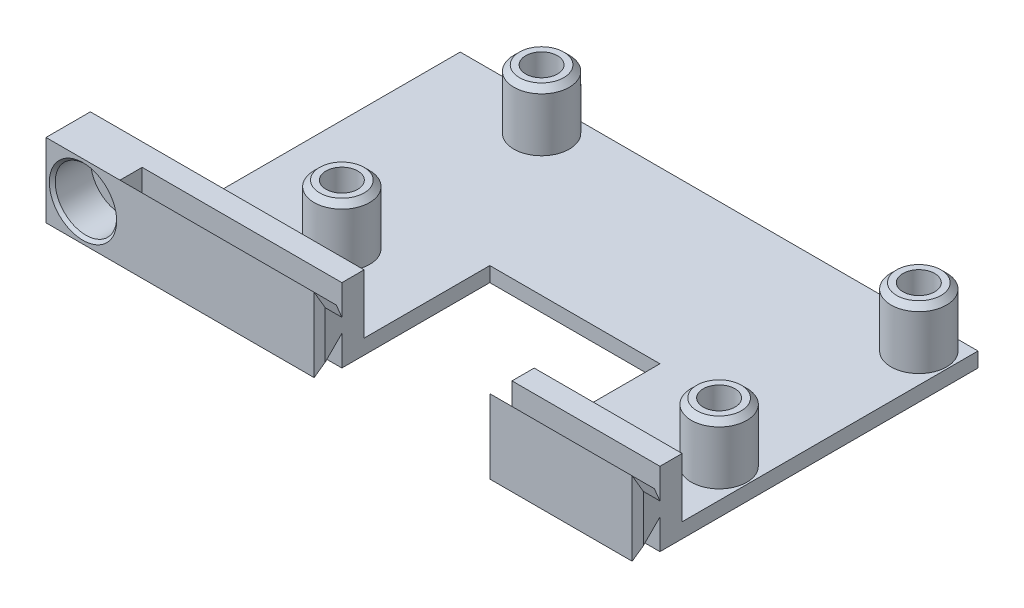
from build123d import *

# Parameters (mm, degrees)
SKETCH1_W                  = 70
SKETCH1_H                  = 35
BOSS_EXTRUDE1_DEPTH        = 2
SKETCH2_R                  = 3.75
BOSS_EXTRUDE2_DEPTH        = 8
SKETCH6_W                  = 70
SKETCH6_H                  = 2
BOSS_EXTRUDE3_DEPTH        = 2
F_4_3_4_3_DIAMETER_HOLE1_D = 4.3
CHAMFER1_SIZE              = 0.75
SKETCH5_W                  = 23
SKETCH5_H                  = 14
CUT_EXTRUDE1_DEPTH         = 79.89866919
SKETCH7_W                  = 27
SKETCH7_H                  = 2
SKETCH7_W_2                = 20
BOSS_EXTRUDE4_DEPTH        = 3
SKETCH9_W                  = 27
SKETCH9_H                  = 10
SKETCH9_W_2                = 20
BOSS_EXTRUDE5_DEPTH        = 3
BOSS_EXTRUDE6_DEPTH        = 20
BOSS_EXTRUDE7_START        = -43
BOSS_EXTRUDE7_DEPTH        = 27
CHAMFER3_SIZE              = 0.75
SKETCH11_W                 = 6
SKETCH11_H                 = 10
BOSS_EXTRUDE8_DEPTH        = 10
SKETCH12_R                 = 4.15
CUT_EXTRUDE2_DEPTH         = 5.2
CHAMFER4_SIZE              = 0.4


with BuildPart() as part:
    # Sketch1 → Boss-Extrude1 (new body)
    with BuildSketch(Plane(origin=(0, 0, 0), x_dir=(1, 0, 0), z_dir=(0, 1, 0))):
        with Locations((35, 17.5)):
            Rectangle(SKETCH1_W, SKETCH1_H)
    extrude(amount=BOSS_EXTRUDE1_DEPTH)

    # Sketch2 → Boss-Extrude2 (add)
    with BuildSketch(Plane(origin=(0, 2, 0), x_dir=(1, 0, 0), z_dir=(0, 1, 0))):
        with Locations(Location((66, 31, 0), (0, 0, 90))):
            Circle(SKETCH2_R)
        with Locations(Location((15, 31, 0), (0, 0, 90))):
            Circle(SKETCH2_R)
        with Locations(Location((15, 4, 0), (0, 0, 90))):
            Circle(SKETCH2_R)
        with Locations(Location((66, 4, 0), (0, 0, 90))):
            Circle(SKETCH2_R)
    extrude(amount=BOSS_EXTRUDE2_DEPTH)

    # Sketch6 → Boss-Extrude3 (add)
    with BuildSketch(Plane.XY):
        with Locations((35, 1)):
            Rectangle(SKETCH6_W, SKETCH6_H)
    extrude(amount=BOSS_EXTRUDE3_DEPTH)

    # Ø4.3 (4.3) Diameter Hole1 (through all)
    with Locations(Plane(origin=(0, 10, 0), x_dir=(1, 0, 0), z_dir=(0, 1, 0))):
        with Locations((66, 31), (15, 31), (15, 4), (66, 4)):
            Hole(F_4_3_4_3_DIAMETER_HOLE1_D / 2)

    # Chamfer1
    chamfer1_edges = [part.edges().sort_by_distance(p)[0] for p in [
        (66, 10, -27.25),
        (15, 10, -27.25),
        (15, 10, -0.25),
        (66, 10, -0.25),
    ]]
    chamfer(chamfer1_edges, length=CHAMFER1_SIZE)

    # Sketch5 → Cut-Extrude1 (cut, through all)
    with BuildSketch(Plane.XZ):
        with Locations((38.5, -5)):
            Rectangle(SKETCH5_W, SKETCH5_H)
    extrude(amount=-CUT_EXTRUDE1_DEPTH, mode=Mode.SUBTRACT)

    # Sketch7 → Boss-Extrude4 (add)
    with BuildSketch(Plane.XY.offset(2)):
        with Locations((13.5, 1)):
            Rectangle(SKETCH7_W, SKETCH7_H)
        with Locations((60, 1)):
            Rectangle(SKETCH7_W_2, SKETCH7_H)
    extrude(amount=BOSS_EXTRUDE4_DEPTH)

    # Sketch9 → Boss-Extrude5 (add)
    with BuildSketch(Plane.XY.offset(5)):
        with Locations((13.5, 5)):
            Rectangle(SKETCH9_W, SKETCH9_H)
        with Locations((60, 5)):
            Rectangle(SKETCH9_W_2, SKETCH9_H)
    extrude(amount=BOSS_EXTRUDE5_DEPTH)

    # Sketch10 → Boss-Extrude6 (add)
    with BuildSketch(Plane(origin=(70, 0, 0), x_dir=(0, 0, -1), z_dir=(1, 0, 0))):
        Polygon((-8, 7), (-11, 10), (-11, 0), (-8, 3), align=None)
    extrude(amount=-BOSS_EXTRUDE6_DEPTH)

    # Sketch10<2> → Boss-Extrude7 (add)
    with BuildSketch(Plane(origin=(70, 0, 0), x_dir=(0, 0, -1), z_dir=(1, 0, 0)).offset(BOSS_EXTRUDE7_START)):
        Polygon((-8, 7), (-11, 10), (-11, 0), (-8, 3), align=None)
    extrude(amount=-BOSS_EXTRUDE7_DEPTH)

    # Chamfer3
    chamfer3_edges = [part.edges().sort_by_distance(p)[0] for p in [
        (70, 8.5, 9.5),
        (70, 5, 11),
        (70, 1.5, 9.5),
        (27, 8.5, 9.5),
        (27, 5, 11),
        (27, 1.5, 9.5),
    ]]
    chamfer(chamfer3_edges, length=CHAMFER3_SIZE)

    # Sketch11 → Boss-Extrude8 (add)
    with BuildSketch(Plane.ZY):
        with Locations((8, 5)):
            Rectangle(SKETCH11_W, SKETCH11_H)
    extrude(amount=BOSS_EXTRUDE8_DEPTH)

    # Sketch12 → Cut-Extrude2 (cut)
    with BuildSketch(Plane.XY.offset(11)):
        with Locations((-5, 5)):
            Circle(SKETCH12_R)
    extrude(amount=-CUT_EXTRUDE2_DEPTH, mode=Mode.SUBTRACT)

    # Chamfer4
    chamfer4_edges = [part.edges().sort_by_distance(p)[0] for p in [
        (-9.15, 5, 11),
    ]]
    chamfer(chamfer4_edges, length=CHAMFER4_SIZE)


solid = part.part
